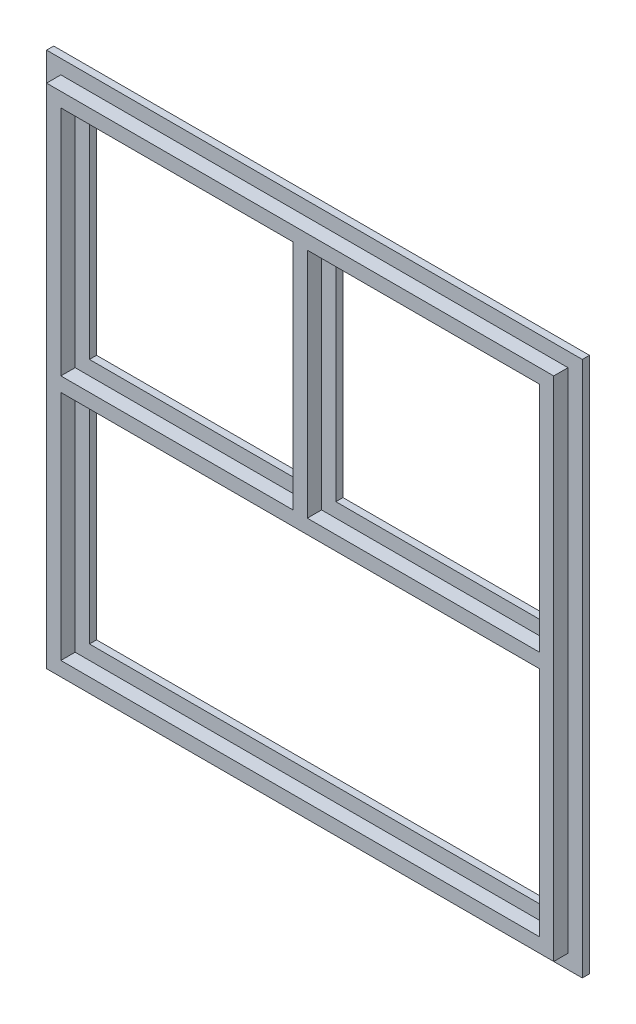
from build123d import *

# Parameters (mm, degrees)
ESBO_O1_W                = 75
ESBO_O1_H                = 75
RESSALTO_EXTRUS_O1_DEPTH = 1
ESBO_O2_W                = 71
ESBO_O2_H                = 71
ESBO_O2_W_2              = 67
ESBO_O2_H_2              = 67
RESSALTO_EXTRUS_O2_DEPTH = 2
ESBO_O3_W                = 28.5
ESBO_O3_H                = 28.5
ESBO_O3_W_2              = 63
CORTE_EXTRUS_O2_DEPTH    = 3
RESSALTO_EXTRUS_O3_DEPTH = 2


with BuildPart() as part:
    # Esboço1 → Ressalto-extrusão1 (new body)
    with BuildSketch(Plane.XY):
        Rectangle(ESBO_O1_W, ESBO_O1_H)
    extrude(amount=RESSALTO_EXTRUS_O1_DEPTH)

    # Esboço2 → Ressalto-extrusão2 (add)
    with BuildSketch(Plane.XY.offset(1)):
        Rectangle(ESBO_O2_W, ESBO_O2_H)
        Rectangle(ESBO_O2_W_2, ESBO_O2_H_2, mode=Mode.SUBTRACT)
    extrude(amount=RESSALTO_EXTRUS_O2_DEPTH)

    # Esboço3 → Corte-extrusão2 (cut)
    with BuildSketch(Plane.XY.offset(1)):
        with Locations((17.25, 17.25)):
            Rectangle(ESBO_O3_W, ESBO_O3_H)
        with Locations((0, -17.25)):
            Rectangle(ESBO_O3_W_2, ESBO_O3_H)
        with Locations((-17.25, 17.25)):
            Rectangle(ESBO_O3_W, ESBO_O3_H)
    extrude(amount=-CORTE_EXTRUS_O2_DEPTH, mode=Mode.SUBTRACT)

    # Esboço4 → Ressalto-extrusão3 (add)
    with BuildSketch(Plane.XY.offset(1)):
        Polygon((0, 33.5), (-1, 33.5), (-1, 1), (-33.5, 1), (-33.5, 0), (-33.5, -1), (33.5, -1), (33.5, 0), (33.5, 1), (1, 1), (1, 33.5), align=None)
    extrude(amount=RESSALTO_EXTRUS_O3_DEPTH)


solid = part.part
